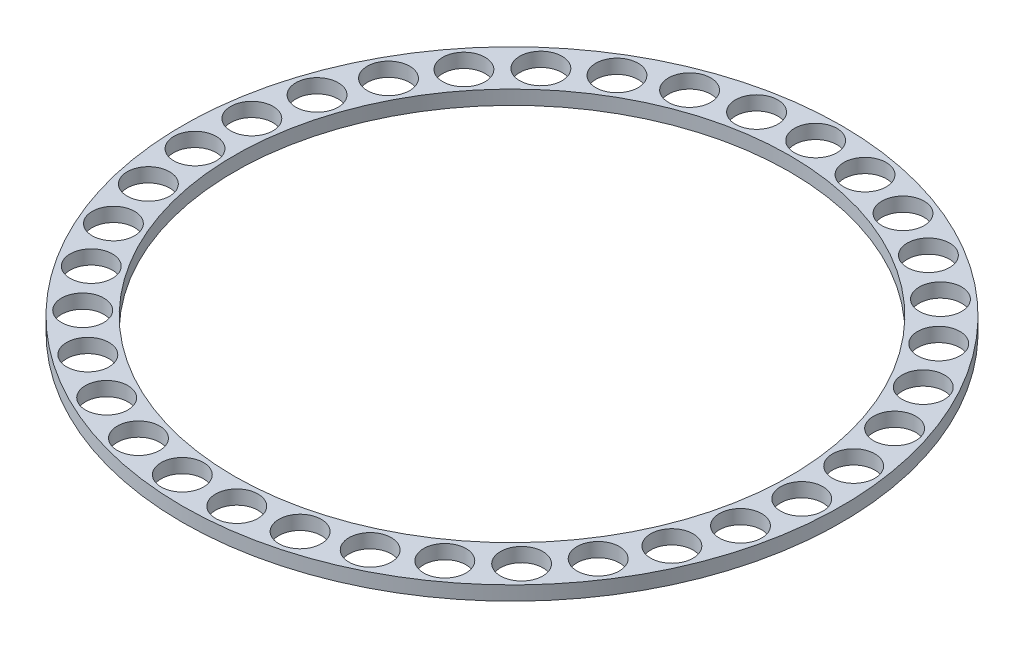
from build123d import *

# Parameters (mm, degrees)
CROQUIS1_R              = 70
CROQUIS1_R_2            = 59
SALIENTE_EXTRUIR1_DEPTH = 1.5
CROQUIS3_R              = 4.5
CORTAR_EXTRUIR1_DEPTH   = 5
MATRIZC1_COUNT          = 35


with BuildPart() as part:
    # Croquis1 → Saliente-Extruir1 (new, symmetric)
    with BuildSketch(Plane(origin=(0, 0, 0), x_dir=(1, 0, 0), z_dir=(0, 1, 0))):
        with Locations(Location((0, 0, 0), (0, 0, 270))):
            Circle(CROQUIS1_R)
        with Locations(Location((0, 0, 0), (0, 0, 270))):
            Circle(CROQUIS1_R_2, mode=Mode.SUBTRACT)
    extrude(amount=SALIENTE_EXTRUIR1_DEPTH, both=True)

    # Croquis3 → Cortar-Extruir1 (cut)
    with BuildSketch(Plane(origin=(0, -1.5, 0), x_dir=(-1, 0, 0), z_dir=(0, -1, 0))):
        with Locations(Location((0, 64.5, 0), (0, 0, 90))):
            Circle(CROQUIS3_R)
    cortar_extruir1 = extrude(amount=-CORTAR_EXTRUIR1_DEPTH, mode=Mode.SUBTRACT)

    # MatrizC1: Cortar-Extruir1 ×35 about axis
    matrizc1_axis = Axis((0, 0, 0), (0, 1, 0))
    for i in range(1, MATRIZC1_COUNT):
        add(cortar_extruir1.rotate(matrizc1_axis, i * 360 / MATRIZC1_COUNT), mode=Mode.SUBTRACT)


solid = part.part
